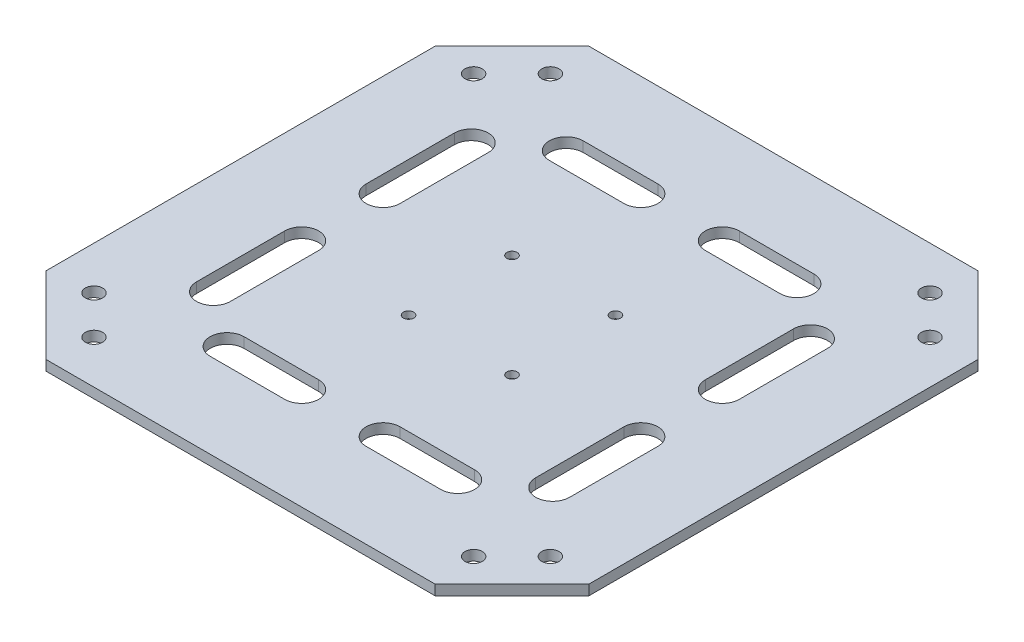
from build123d import *

# Parameters (mm, degrees)
SKETCH1_W                                  = 160
SKETCH1_H                                  = 160
BOSS_EXTRUDE1_DEPTH                        = 3
CUT_EXTRUDE2_REACH                         = 115.177
CUT_EXTRUDE1_REACH                         = 115.177
SKETCH2_R                                  = 2.55
MIRROR2_AT_THE_SECOND_PLANE_COPY_1_REACH   = 115.177
MIRROR2_AT_THE_SECOND_PLANE_COPY_2_REACH   = 115.177
MIRROR2_AT_THE_SECOND_PLANE_COPY_2_SKETC_R = 2.55
CUT_EXTRUDE3_REACH                         = 115.177
SKETCH8_R                                  = 1.525
CUT_EXTRUDE4_REACH                         = 115.177
SKETCH10_R                                 = 2.85
CUT_EXTRUDE6_DEPTH                         = 1


with BuildPart() as part:
    # Sketch1 → Boss-Extrude1 (new body)
    with BuildSketch(Plane(origin=(0, 0, 0), x_dir=(1, 0, 0), z_dir=(0, 1, 0))):
        Rectangle(SKETCH1_W, SKETCH1_H)
    extrude(amount=-BOSS_EXTRUDE1_DEPTH)

    # Sketch6 → Cut-Extrude2 (cut, up to next)
    with BuildSketch(Plane(origin=(0, 0, 0), x_dir=(1, 0, 0), z_dir=(0, 1, 0)), mode=Mode.PRIVATE) as cut_extrude2_sk1:
        Polygon((-80, -57.372583002), (-57.372583002, -80), (-80, -80), align=None)
    cut_extrude2_tool1 = extrude(cut_extrude2_sk1.sketch, amount=-CUT_EXTRUDE2_REACH, mode=Mode.PRIVATE) & part.part
    cut_extrude2 = cut_extrude2_tool1.solids().sort_by_distance((-72.457528, 0, 72.457528))[0]
    add(cut_extrude2, mode=Mode.SUBTRACT)

    # Sketch2 → Cut-Extrude1 (cut, up to next)
    with BuildSketch(Plane(origin=(0, 0, 0), x_dir=(1, 0, 0), z_dir=(0, 1, 0)), mode=Mode.PRIVATE) as cut_extrude1_sk1:
        with Locations(Location((-67.272077939, -55.95836944, 0), (0, 0, 270))):
            Circle(SKETCH2_R)
    cut_extrude1_tool1 = extrude(cut_extrude1_sk1.sketch, amount=-CUT_EXTRUDE1_REACH, mode=Mode.PRIVATE) & part.part
    # Sketch2 → Cut-Extrude1 (cut, up to next)
    with BuildSketch(Plane(origin=(0, 0, 0), x_dir=(1, 0, 0), z_dir=(0, 1, 0)), mode=Mode.PRIVATE) as cut_extrude1_sk2:
        with Locations(Location((-55.95836944, -67.272077939, 0), (0, 0, 270))):
            Circle(SKETCH2_R)
    cut_extrude1_tool2 = extrude(cut_extrude1_sk2.sketch, amount=-CUT_EXTRUDE1_REACH, mode=Mode.PRIVATE) & part.part
    cut_extrude1_1 = cut_extrude1_tool1.solids().sort_by_distance((-67.272078, 0, 55.958369))[0]
    add(cut_extrude1_1, mode=Mode.SUBTRACT)
    cut_extrude1_2 = cut_extrude1_tool2.solids().sort_by_distance((-55.958369, 0, 67.272078))[0]
    add(cut_extrude1_2, mode=Mode.SUBTRACT)
    cut_extrude1 = cut_extrude1_1 + cut_extrude1_2  # Cut-Extrude1 as one shape, for the pattern or mirror that repeats it

    # Mirror2: Cut-Extrude2, Cut-Extrude1 across plane
    add(cut_extrude2.mirror(Plane(origin=(0, 0, 0), x_dir=(0, 0, 1), z_dir=(1, 0, 0))), mode=Mode.SUBTRACT)
    add(cut_extrude1.mirror(Plane(origin=(0, 0, 0), x_dir=(0, 0, 1), z_dir=(1, 0, 0))), mode=Mode.SUBTRACT)

    # Mirror2 at the second plane: Cut-Extrude2, Cut-Extrude1 across plane
    add(cut_extrude2.mirror(Plane.XY), mode=Mode.SUBTRACT)
    add(cut_extrude1.mirror(Plane.XY), mode=Mode.SUBTRACT)

    # Mirror2 at the second plane copy 1 sketc → Mirror2 at the second plane copy 1 (cut, up to next)
    with BuildSketch(Plane(origin=(0, 0, 0), x_dir=(-1, 0, 0), z_dir=(0, 1, 0)), mode=Mode.PRIVATE) as mirror2_at_the_second_plane_copy_1_sk1:
        Polygon((-80, -57.372583002), (-57.372583002, -80), (-80, -80), align=None)
    mirror2_at_the_second_plane_copy_1_tool1 = extrude(mirror2_at_the_second_plane_copy_1_sk1.sketch, amount=-MIRROR2_AT_THE_SECOND_PLANE_COPY_1_REACH, mode=Mode.PRIVATE) & part.part
    add(mirror2_at_the_second_plane_copy_1_tool1.solids().sort_by_distance((72.457528, 0, -72.457528))[0], mode=Mode.SUBTRACT)

    # Mirror2 at the second plane copy 2 sketc → Mirror2 at the second plane copy 2 (cut, up to next)
    with BuildSketch(Plane(origin=(0, 0, 0), x_dir=(-1, 0, 0), z_dir=(0, 1, 0)), mode=Mode.PRIVATE) as mirror2_at_the_second_plane_copy_2_sk1:
        with Locations(Location((-67.272077939, -55.95836944, 0), (0, 0, 270))):
            Circle(MIRROR2_AT_THE_SECOND_PLANE_COPY_2_SKETC_R)
    mirror2_at_the_second_plane_copy_2_tool1 = extrude(mirror2_at_the_second_plane_copy_2_sk1.sketch, amount=-MIRROR2_AT_THE_SECOND_PLANE_COPY_2_REACH, mode=Mode.PRIVATE) & part.part
    # Mirror2 at the second plane copy 2 sketc → Mirror2 at the second plane copy 2 (cut, up to next)
    with BuildSketch(Plane(origin=(0, 0, 0), x_dir=(-1, 0, 0), z_dir=(0, 1, 0)), mode=Mode.PRIVATE) as mirror2_at_the_second_plane_copy_2_sk2:
        with Locations(Location((-55.95836944, -67.272077939, 0), (0, 0, 270))):
            Circle(MIRROR2_AT_THE_SECOND_PLANE_COPY_2_SKETC_R)
    mirror2_at_the_second_plane_copy_2_tool2 = extrude(mirror2_at_the_second_plane_copy_2_sk2.sketch, amount=-MIRROR2_AT_THE_SECOND_PLANE_COPY_2_REACH, mode=Mode.PRIVATE) & part.part
    add(mirror2_at_the_second_plane_copy_2_tool1.solids().sort_by_distance((67.272078, 0, -55.958369))[0], mode=Mode.SUBTRACT)
    add(mirror2_at_the_second_plane_copy_2_tool2.solids().sort_by_distance((55.958369, 0, -67.272078))[0], mode=Mode.SUBTRACT)

    # Sketch8 → Cut-Extrude3 (cut, up to next)
    with BuildSketch(Plane(origin=(0, 0, 0), x_dir=(1, 0, 0), z_dir=(0, 1, 0)), mode=Mode.PRIVATE) as cut_extrude3_sk1:
        with Locations(Location((-15.25, 15.25, 0), (0, 0, 270))):
            Circle(SKETCH8_R)
    cut_extrude3_tool1 = extrude(cut_extrude3_sk1.sketch, amount=-CUT_EXTRUDE3_REACH, mode=Mode.PRIVATE) & part.part
    # Sketch8 → Cut-Extrude3 (cut, up to next)
    with BuildSketch(Plane(origin=(0, 0, 0), x_dir=(1, 0, 0), z_dir=(0, 1, 0)), mode=Mode.PRIVATE) as cut_extrude3_sk2:
        with Locations(Location((-15.25, -15.25, 0), (0, 0, 270))):
            Circle(SKETCH8_R)
    cut_extrude3_tool2 = extrude(cut_extrude3_sk2.sketch, amount=-CUT_EXTRUDE3_REACH, mode=Mode.PRIVATE) & part.part
    # Sketch8 → Cut-Extrude3 (cut, up to next)
    with BuildSketch(Plane(origin=(0, 0, 0), x_dir=(1, 0, 0), z_dir=(0, 1, 0)), mode=Mode.PRIVATE) as cut_extrude3_sk3:
        with Locations(Location((15.25, -15.25, 0), (0, 0, 270))):
            Circle(SKETCH8_R)
    cut_extrude3_tool3 = extrude(cut_extrude3_sk3.sketch, amount=-CUT_EXTRUDE3_REACH, mode=Mode.PRIVATE) & part.part
    # Sketch8 → Cut-Extrude3 (cut, up to next)
    with BuildSketch(Plane(origin=(0, 0, 0), x_dir=(1, 0, 0), z_dir=(0, 1, 0)), mode=Mode.PRIVATE) as cut_extrude3_sk4:
        with Locations(Location((15.25, 15.25, 0), (0, 0, 270))):
            Circle(SKETCH8_R)
    cut_extrude3_tool4 = extrude(cut_extrude3_sk4.sketch, amount=-CUT_EXTRUDE3_REACH, mode=Mode.PRIVATE) & part.part
    add(cut_extrude3_tool1.solids().sort_by_distance((-15.25, 0, -15.25))[0], mode=Mode.SUBTRACT)
    add(cut_extrude3_tool2.solids().sort_by_distance((-15.25, 0, 15.25))[0], mode=Mode.SUBTRACT)
    add(cut_extrude3_tool3.solids().sort_by_distance((15.25, 0, 15.25))[0], mode=Mode.SUBTRACT)
    add(cut_extrude3_tool4.solids().sort_by_distance((15.25, 0, -15.25))[0], mode=Mode.SUBTRACT)

    # Sketch9 → Cut-Extrude4 (cut, up to next)
    with BuildSketch(Plane(origin=(0, 0, 0), x_dir=(1, 0, 0), z_dir=(0, 1, 0)), mode=Mode.PRIVATE) as cut_extrude4_sk1:
        with BuildLine():
            Line((-45, 38), (-45, 12))
            ThreePointArc((-45, 12), (-50, 7), (-55, 12))
            Line((-55, 12), (-55, 38))
            ThreePointArc((-55, 38), (-50, 43), (-45, 38))
        make_face()
    cut_extrude4_tool1 = extrude(cut_extrude4_sk1.sketch, amount=-CUT_EXTRUDE4_REACH, mode=Mode.PRIVATE) & part.part
    # Sketch9 → Cut-Extrude4 (cut, up to next)
    with BuildSketch(Plane(origin=(0, 0, 0), x_dir=(1, 0, 0), z_dir=(0, 1, 0)), mode=Mode.PRIVATE) as cut_extrude4_sk2:
        with BuildLine():
            Line((-45, -12), (-45, -38))
            ThreePointArc((-45, -38), (-50, -43), (-55, -38))
            Line((-55, -38), (-55, -12))
            ThreePointArc((-55, -12), (-50, -7), (-45, -12))
        make_face()
    cut_extrude4_tool2 = extrude(cut_extrude4_sk2.sketch, amount=-CUT_EXTRUDE4_REACH, mode=Mode.PRIVATE) & part.part
    # Sketch9 → Cut-Extrude4 (cut, up to next)
    with BuildSketch(Plane(origin=(0, 0, 0), x_dir=(1, 0, 0), z_dir=(0, 1, 0)), mode=Mode.PRIVATE) as cut_extrude4_sk3:
        with BuildLine():
            Line((-34, 55), (-12, 55))
            ThreePointArc((-12, 55), (-7, 50), (-12, 45))
            Line((-12, 45), (-34, 45))
            ThreePointArc((-34, 45), (-39, 50), (-34, 55))
        make_face()
    cut_extrude4_tool3 = extrude(cut_extrude4_sk3.sketch, amount=-CUT_EXTRUDE4_REACH, mode=Mode.PRIVATE) & part.part
    # Sketch9 → Cut-Extrude4 (cut, up to next)
    with BuildSketch(Plane(origin=(0, 0, 0), x_dir=(1, 0, 0), z_dir=(0, 1, 0)), mode=Mode.PRIVATE) as cut_extrude4_sk4:
        with BuildLine():
            Line((12, 55), (34, 55))
            ThreePointArc((34, 55), (39, 50), (34, 45))
            Line((34, 45), (12, 45))
            ThreePointArc((12, 45), (7, 50), (12, 55))
        make_face()
    cut_extrude4_tool4 = extrude(cut_extrude4_sk4.sketch, amount=-CUT_EXTRUDE4_REACH, mode=Mode.PRIVATE) & part.part
    cut_extrude4_1 = cut_extrude4_tool1.solids().sort_by_distance((-50, 0, -25))[0]
    add(cut_extrude4_1, mode=Mode.SUBTRACT)
    cut_extrude4_2 = cut_extrude4_tool2.solids().sort_by_distance((-50, 0, 25))[0]
    add(cut_extrude4_2, mode=Mode.SUBTRACT)
    cut_extrude4_3 = cut_extrude4_tool3.solids().sort_by_distance((-23, 0, -50))[0]
    add(cut_extrude4_3, mode=Mode.SUBTRACT)
    cut_extrude4_4 = cut_extrude4_tool4.solids().sort_by_distance((23, 0, -50))[0]
    add(cut_extrude4_4, mode=Mode.SUBTRACT)
    cut_extrude4 = cut_extrude4_1 + cut_extrude4_2 + cut_extrude4_3 + cut_extrude4_4  # Cut-Extrude4 as one shape, for the pattern or mirror that repeats it

    # Mirror3: Cut-Extrude4 across plane
    add(cut_extrude4.mirror(Plane.XY), mode=Mode.SUBTRACT)

    # Mirror3 at the second plane: Cut-Extrude4 across plane
    add(cut_extrude4.mirror(Plane(origin=(0, 0, 0), x_dir=(0, 0, 1), z_dir=(1, 0, 0))), mode=Mode.SUBTRACT)

    # Sketch10 → Cut-Extrude6 (cut)
    with BuildSketch(Plane(origin=(0, -3, 0), x_dir=(1, 0, 0), z_dir=(0, 1, 0))):
        with Locations(Location((-15.25, 15.25, 0), (0, 0, 270))):
            Circle(SKETCH10_R)
        with Locations(Location((15.25, 15.25, 0), (0, 0, 270))):
            Circle(SKETCH10_R)
        with Locations(Location((15.25, -15.25, 0), (0, 0, 270))):
            Circle(SKETCH10_R)
        with Locations(Location((-15.25, -15.25, 0), (0, 0, 270))):
            Circle(SKETCH10_R)
    extrude(amount=CUT_EXTRUDE6_DEPTH, mode=Mode.SUBTRACT)


solid = part.part
